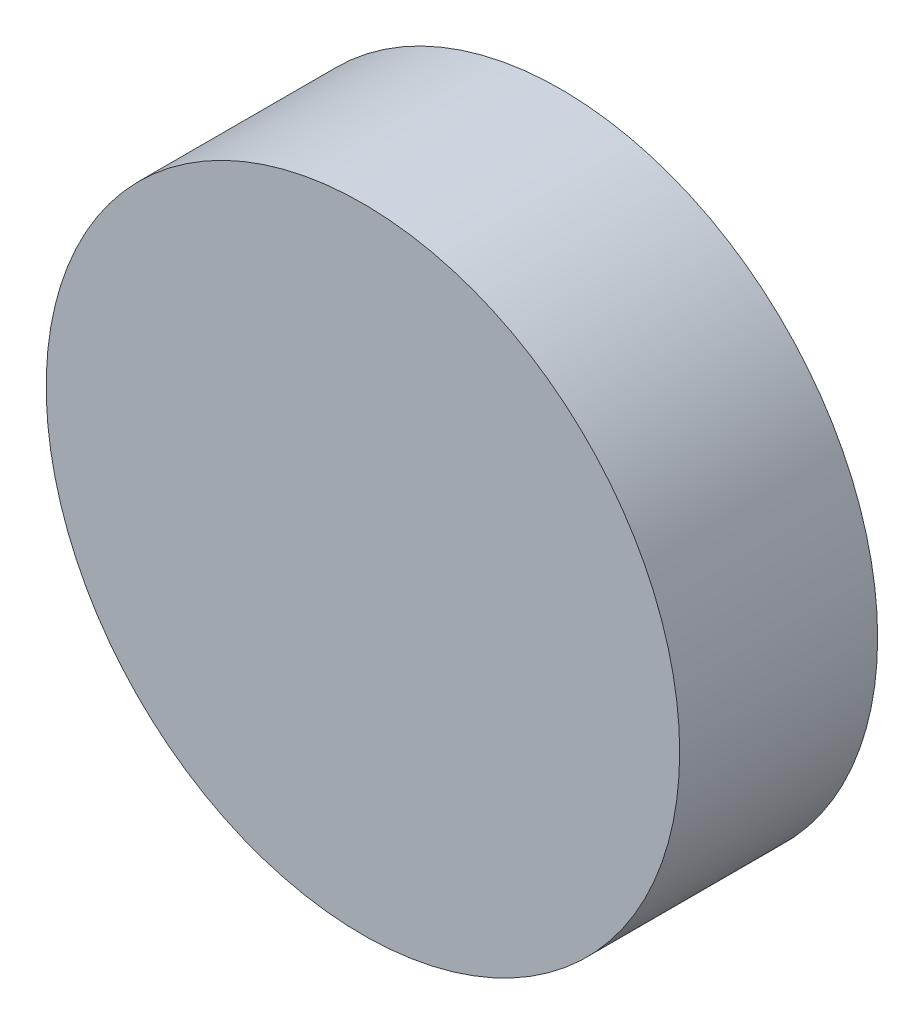
from build123d import *

# Parameters (mm, degrees)
SKETCH1_R           = 8
BOSS_EXTRUDE1_DEPTH = 5


with BuildPart() as part:
    # Sketch1 → Boss-Extrude1 (new body)
    with BuildSketch(Plane.XY):
        Circle(SKETCH1_R)
    extrude(amount=BOSS_EXTRUDE1_DEPTH)


solid = part.part
